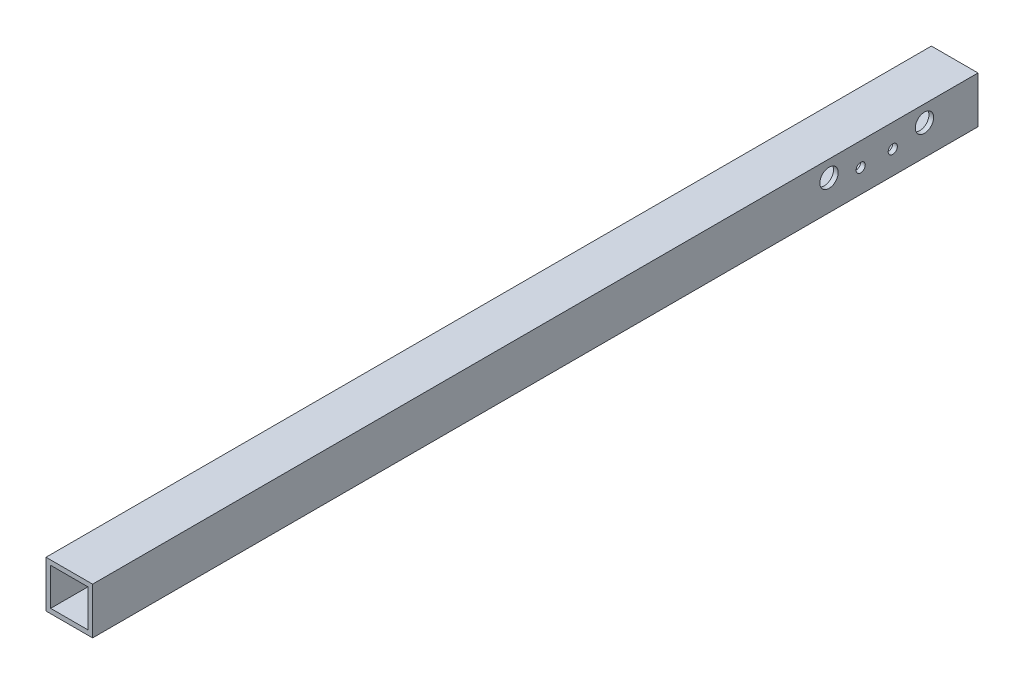
from build123d import *

# Parameters (mm, degrees)
SKETCH1_W               = 25.4
SKETCH1_H               = 25.4
SKETCH1_W_2             = 20.32
SKETCH1_H_2             = 20.32
BOSS_EXTRUDE1_DEPTH     = 241.3
CUT_EXTRUDE1_DEPTH      = 243.965306165
CUT_EXTRUDE1_DEPTH_BACK = 243.965306165
SKETCH2_R               = 5
CUT_EXTRUDE3_DEPTH      = 243.965306165
CUT_EXTRUDE3_DEPTH_BACK = 243.965306165
SKETCH5_R               = 2.5


with BuildPart() as part:
    # Sketch1 → Boss-Extrude1 (new, symmetric)
    with BuildSketch(Plane.XY):
        Rectangle(SKETCH1_W, SKETCH1_H)
        Rectangle(SKETCH1_W_2, SKETCH1_H_2, mode=Mode.SUBTRACT)
    extrude(amount=BOSS_EXTRUDE1_DEPTH, both=True)

    # Sketch2 → Cut-Extrude1 (cut, two sides: drawn at the far end of the back side and taken through both)
    with BuildSketch(Plane.ZY.offset(12.7).offset(-CUT_EXTRUDE1_DEPTH_BACK)):
        with Locations(Location((-212.1, 3.81, 0), (0, 0, 270))):
            Circle(SKETCH2_R)
        with Locations(Location((-160.1, 3.81, 0), (0, 0, 270))):
            Circle(SKETCH2_R)
    extrude(amount=CUT_EXTRUDE1_DEPTH + CUT_EXTRUDE1_DEPTH_BACK, mode=Mode.SUBTRACT)

    # Sketch5 → Cut-Extrude3 (cut, two sides: drawn at the far end of the back side and taken through both)
    with BuildSketch(Plane.ZY.offset(12.7).offset(-CUT_EXTRUDE3_DEPTH_BACK)):
        with Locations(Location((-194.85, 0, 0), (0, 0, 270))):
            Circle(SKETCH5_R)
        with Locations(Location((-177.35, 0, 0), (0, 0, 270))):
            Circle(SKETCH5_R)
    extrude(amount=CUT_EXTRUDE3_DEPTH + CUT_EXTRUDE3_DEPTH_BACK, mode=Mode.SUBTRACT)


solid = part.part
